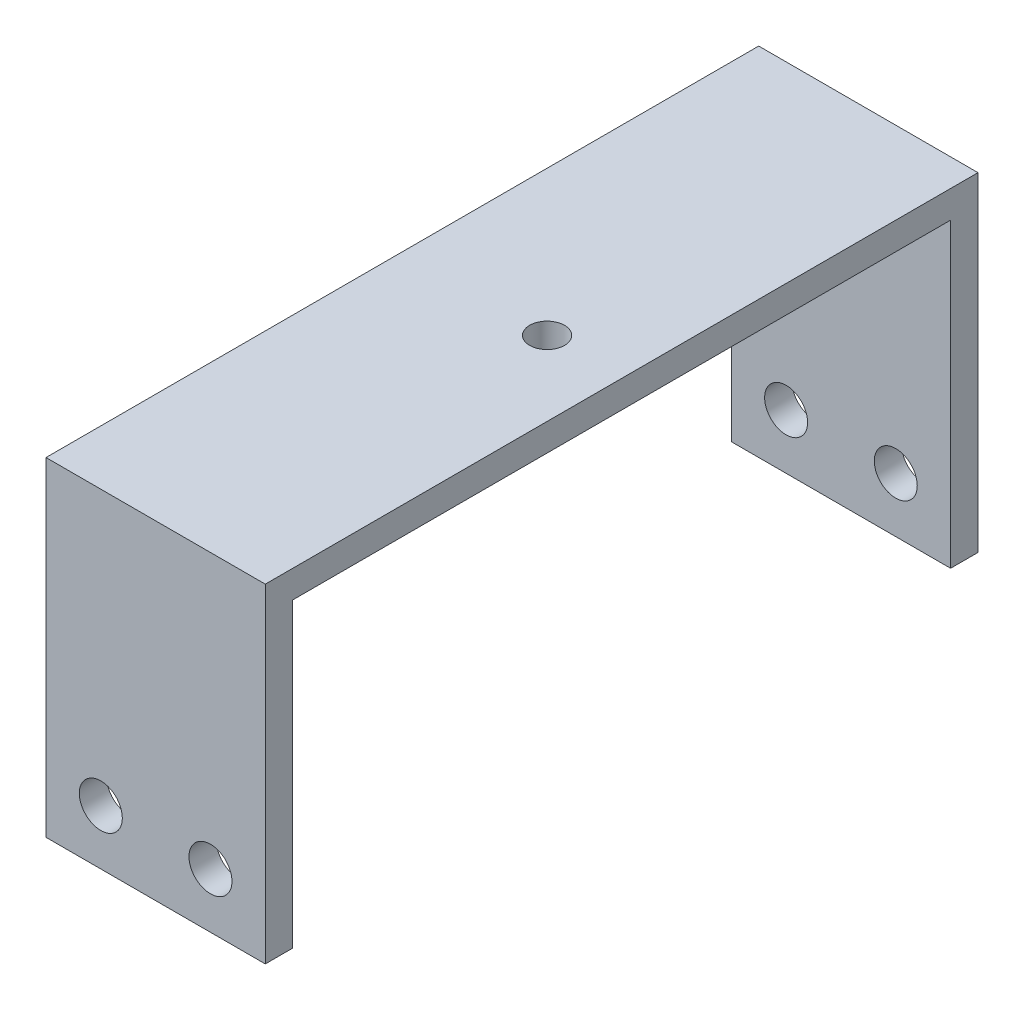
from build123d import *

# Parameters (mm, degrees)
BOSS_EXTRUDE1_DEPTH        = 25.4
F_10_32_TAPPED_HOLE1_D     = 4.0386
F_10_32_TAPPED_HOLE1_DEPTH = 13.716
F_10_32_TAPPED_HOLE1_TIP   = 1.213317848
F_9_0_196_DIAMETER_HOLE1_D = 4.9784


with BuildPart() as part:
    # Sketch1 → Boss-Extrude1 (new body)
    with BuildSketch(Plane(origin=(0, 0, 0), x_dir=(0, 0, -1), z_dir=(1, 0, 0))):
        Polygon((82.55, 0), (79.375, 0), (79.375, 34.925), (3.175, 34.925), (3.175, 0), (0, 0), (0, 38.1), (82.55, 38.1), align=None)
    extrude(amount=BOSS_EXTRUDE1_DEPTH)

    # #10-32 Tapped Hole1
    with Locations(Plane(origin=(0, 38.1, 0), x_dir=(1, 0, 0), z_dir=(0, 1, 0))):
        with Locations((16.764, 41.275)):
            Hole(F_10_32_TAPPED_HOLE1_D / 2, depth=F_10_32_TAPPED_HOLE1_DEPTH)
            with Locations((0, 0, -(F_10_32_TAPPED_HOLE1_DEPTH + F_10_32_TAPPED_HOLE1_TIP / 2))):  # 118° drill point
                Cone(0, F_10_32_TAPPED_HOLE1_D / 2, F_10_32_TAPPED_HOLE1_TIP, mode=Mode.SUBTRACT)

    # #9 (0.196) Diameter Hole1 (through all)
    with Locations(Plane.XY):
        with Locations((6.35, 6.35), (19.05, 6.35)):
            Hole(F_9_0_196_DIAMETER_HOLE1_D / 2)


solid = part.part
